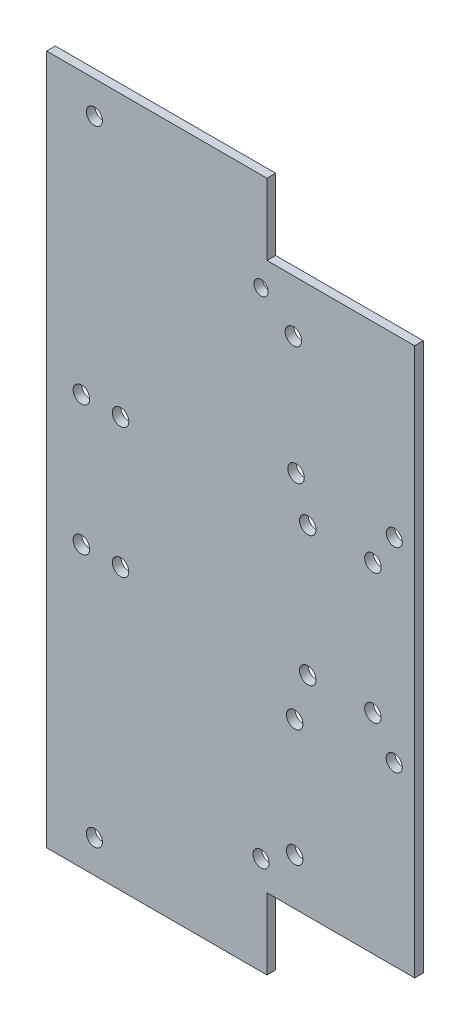
from build123d import *

# Parameters (mm, degrees)
SKETCH2_R               = 2.3495
SKETCH2_R_2             = 2.0955
BOSS_EXTRUDE1_DEPTH     = 2.54
SKETCH3_W               = 31.75
SKETCH3_H               = 44.323
BOSS_EXTRUDE2_DEPTH     = 2.54
SKETCH4_R               = 2.413
CUT_EXTRUDE1_DEPTH      = 238.743265275
SKETCH5_R               = 2.413
CUT_EXTRUDE2_DEPTH      = 238.743265275
SKETCH6_R               = 2.413
CUT_EXTRUDE3_DEPTH      = 238.743265275
SKETCH7_R               = 2.413
CUT_EXTRUDE4_DEPTH      = 238.743265275
SKETCH8_W               = 7.994763
SKETCH8_H               = 21.113506736
SKETCH8_W_2             = 21.493659396
SKETCH8_H_2             = 28.960940125
CUT_EXTRUDE5_DEPTH      = 238.743265275
CUT_EXTRUDE6_DEPTH      = 238.743265275
CUT_EXTRUDE6_DEPTH_BACK = 238.743265275


with BuildPart() as part:
    # Sketch2 → Boss-Extrude1 (new body)
    with BuildSketch(Plane(origin=(0, 0, 0), x_dir=(-1, 0, 0), z_dir=(0, 0, 1))):
        Polygon((-2.930050059, 168.708281075), (38.709428475, 168.708281075), (38.709428475, 189.536281075), (143.497061781, 189.536281075), (104.617436481, 110.859781075), (72.867436481, 110.859781075), (72.867436481, 66.536781075), (104.617436481, 66.536781075), (143.497061781, -12.139718925), (38.709428475, -12.139718925), (38.709428475, 8.688281075), (-2.930050059, 8.688281075), align=None)
        with Locations(Location((41.95655448, 160.961281075, 0), (0, 0, 180))):
            Circle(SKETCH2_R, mode=Mode.SUBTRACT)
        with Locations(Location((90.673911143, 180.011281075, 0), (0, 0, 180))):
            Circle(SKETCH2_R, mode=Mode.SUBTRACT)
        with Locations(Location((90.673911143, -2.614718925, 0), (0, 0, 180))):
            Circle(SKETCH2_R, mode=Mode.SUBTRACT)
        with Locations(Location((3.035061781, 117.209781075, 0), (0, 0, 180))):
            Circle(SKETCH2_R, mode=Mode.SUBTRACT)
        with Locations(Location((3.035061781, 60.186781075, 0), (0, 0, 180))):
            Circle(SKETCH2_R, mode=Mode.SUBTRACT)
        with Locations(Location((41.95655448, 16.435281075, 0), (0, 0, 180))):
            Circle(SKETCH2_R_2, mode=Mode.SUBTRACT)
    extrude(amount=BOSS_EXTRUDE1_DEPTH)

    # Sketch3 → Boss-Extrude2 (add)
    with BuildSketch(Plane.XY.offset(2.54)):
        with Locations((-88.742436481, -88.698281075)):
            Rectangle(SKETCH3_W, SKETCH3_H)
    extrude(amount=-BOSS_EXTRUDE2_DEPTH)

    # Sketch4 → Cut-Extrude1 (cut, through all)
    with BuildSketch(Plane.XY.offset(2.54)):
        with Locations((-94.457436481, -69.711781075)):
            Circle(SKETCH4_R)
        with Locations((-83.027436481, -69.711781075)):
            Circle(SKETCH4_R)
        with Locations((-28.311949941, -69.711781075)):
            Circle(SKETCH4_R)
        with Locations((-9.261949941, -69.711781075)):
            Circle(SKETCH4_R)
        with Locations(Location((-9.261949941, -107.684781075, 0), (0, 0, 180))):
            Circle(SKETCH4_R)
        with Locations(Location((-28.311949941, -107.684781075, 0), (0, 0, 180))):
            Circle(SKETCH4_R)
        with Locations(Location((-83.027436481, -107.684781075, 0), (0, 0, 180))):
            Circle(SKETCH4_R)
        with Locations(Location((-94.457436481, -107.684781075, 0), (0, 0, 180))):
            Circle(SKETCH4_R)
    extrude(amount=-CUT_EXTRUDE1_DEPTH, mode=Mode.SUBTRACT)

    # Sketch5 → Cut-Extrude2 (cut, through all)
    with BuildSketch(Plane.XY.offset(2.54)):
        with Locations((-31.738991634, -58.273080522)):
            Circle(SKETCH5_R)
    extrude(amount=-CUT_EXTRUDE2_DEPTH, mode=Mode.SUBTRACT)

    # Sketch6 → Cut-Extrude3 (cut, through all)
    with BuildSketch(Plane.XY.offset(2.54)):
        with Locations((-32.511395831, -23.991781075)):
            Circle(SKETCH6_R)
    extrude(amount=-CUT_EXTRUDE3_DEPTH, mode=Mode.SUBTRACT)

    # Sketch7 → Cut-Extrude4 (cut, through all)
    with BuildSketch(Plane.XY.offset(2.54)):
        with Locations((-32.140467993, -155.071444629)):
            Circle(SKETCH7_R)
        with Locations((-32.140467993, -120.781444629)):
            Circle(SKETCH7_R)
    extrude(amount=-CUT_EXTRUDE4_DEPTH, mode=Mode.SUBTRACT)

    # Sketch8 → Cut-Extrude5 (cut, through all)
    with BuildSketch(Plane.XY.offset(2.54)):
        with Locations((-36.236046975, 1.868472293)):
            Rectangle(SKETCH8_W, SKETCH8_H)
        with Locations((-29.486598777, -183.188751137)):
            Rectangle(SKETCH8_W_2, SKETCH8_H_2)
    extrude(amount=-CUT_EXTRUDE5_DEPTH, mode=Mode.SUBTRACT)

    # Sketch9 → Cut-Extrude6 (cut, two sides: drawn at the far end of the back side and taken through both)
    with BuildSketch(Plane.XY.offset(2.54).offset(-CUT_EXTRUDE6_DEPTH_BACK)):
        Polygon((-104.617436481, -66.536781075), (-104.617436481, 15.636566552), (-183.179161499, 15.636566552), (-188.262141255, -199.721259961), (-104.617436481, -202.664037714), align=None)
    extrude(amount=CUT_EXTRUDE6_DEPTH + CUT_EXTRUDE6_DEPTH_BACK, mode=Mode.SUBTRACT)


solid = part.part
